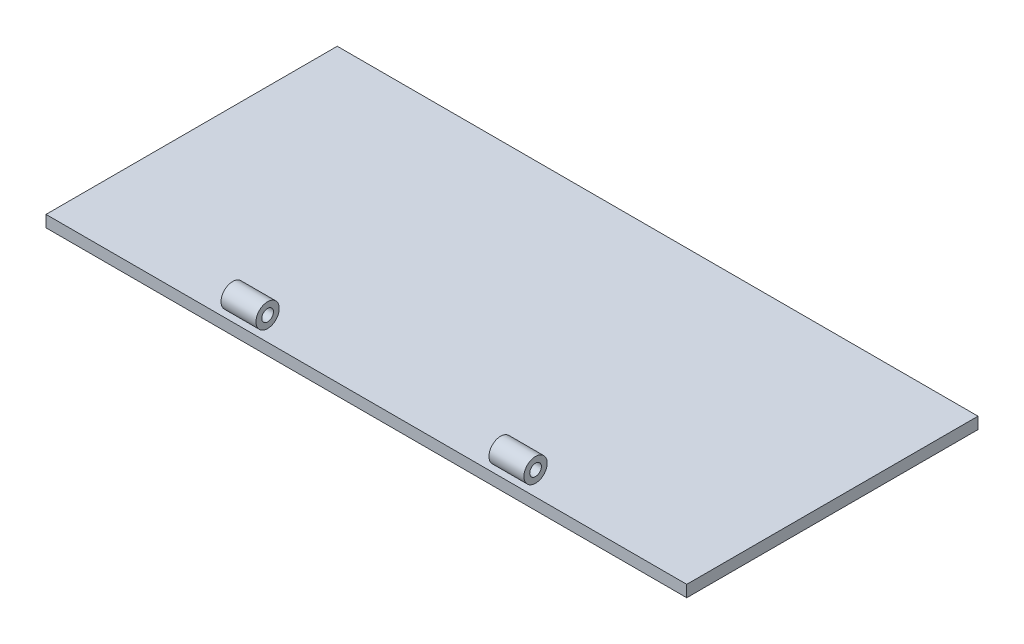
from build123d import *

# Parameters (mm, degrees)
SKETCH1_R             = 10
BOSS_EXTRUDE3_DEPTH   = 550
SKETCH1_W             = 250
SKETCH1_H             = 10
BOSS_EXTRUDE3_2_DEPTH = 550
CUT_EXTRUDE3_START    = -140
SKETCH5_R             = 10
CUT_EXTRUDE3_DEPTH    = 140
SKETCH6_R             = 10
CUT_EXTRUDE4_DEPTH    = 380
SKETCH7_R             = 5
CUT_EXTRUDE5_DEPTH    = 380
SKETCH8_R             = 10
BOSS_EXTRUDE5_DEPTH   = 180
SKETCH10_R            = 10
CUT_EXTRUDE6_DEPTH    = 150
SKETCH11_R            = 5
CUT_EXTRUDE7_DEPTH    = 150


with BuildPart() as part:
    # Sketch1 → Boss-Extrude3 (new body)
    with BuildSketch(Plane(origin=(0, 0, 0), x_dir=(0, 0, -1), z_dir=(1, 0, 0))):
        with Locations((-83.293495175, 27.709808525)):
            Circle(SKETCH1_R)
    extrude(amount=BOSS_EXTRUDE3_DEPTH)

    # Sketch5 → Cut-Extrude3 (cut)
    with BuildSketch(Plane(origin=(550, 0, 0), x_dir=(0, 0, -1), z_dir=(1, 0, 0)).offset(CUT_EXTRUDE3_START)):
        with Locations((-83.293495175, 27.709808525)):
            Circle(SKETCH5_R)
    extrude(amount=CUT_EXTRUDE3_DEPTH, mode=Mode.SUBTRACT)

    # Sketch6 → Cut-Extrude4 (cut)
    with BuildSketch(Plane.ZY):
        with Locations((83.293495175, 27.709808525)):
            Circle(SKETCH6_R)
    extrude(amount=-CUT_EXTRUDE4_DEPTH, mode=Mode.SUBTRACT)

    # Sketch7 → Cut-Extrude5 (cut)
    with BuildSketch(Plane.ZY.offset(-380)):
        with Locations((83.293495175, 27.709808525)):
            Circle(SKETCH7_R)
    extrude(amount=-CUT_EXTRUDE5_DEPTH, mode=Mode.SUBTRACT)


with BuildPart() as body_2:
    # Sketch1 → Boss-Extrude3 2 (new body)
    with BuildSketch(Plane(origin=(0, 0, 0), x_dir=(0, 0, -1), z_dir=(1, 0, 0))):
        with Locations((31.484962406, 12.709808525)):
            Rectangle(SKETCH1_W, SKETCH1_H)
    extrude(amount=BOSS_EXTRUDE3_2_DEPTH)


with BuildPart() as body_3:
    # Sketch8 → Boss-Extrude5 (new body)
    with BuildSketch(Plane.ZY):
        with Locations((83.293495175, 27.709808525)):
            Circle(SKETCH8_R)
    extrude(amount=-BOSS_EXTRUDE5_DEPTH)

    # Sketch10 → Cut-Extrude6 (cut)
    with BuildSketch(Plane.ZY):
        with Locations((83.293495175, 27.709808525)):
            Circle(SKETCH10_R)
    extrude(amount=-CUT_EXTRUDE6_DEPTH, mode=Mode.SUBTRACT)

    # Sketch11 → Cut-Extrude7 (cut)
    with BuildSketch(Plane.ZY.offset(-150)):
        with Locations((83.293495175, 27.709808525)):
            Circle(SKETCH11_R)
    extrude(amount=-CUT_EXTRUDE7_DEPTH, mode=Mode.SUBTRACT)


solid = Compound([part.part, body_2.part, body_3.part])
